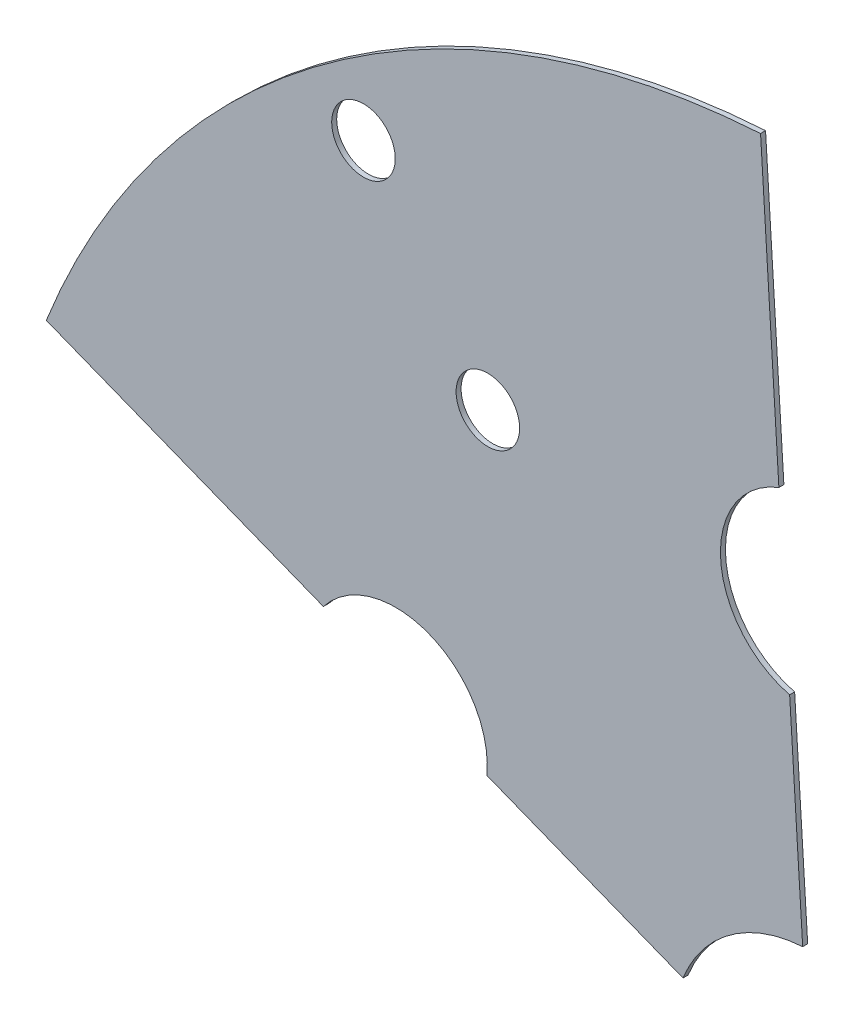
from build123d import *

# Parameters (mm, degrees)
BOSS_EXTRUDE1_DEPTH = 0.3
SKETCH7_R           = 1.905
CUT_EXTRUDE3_DEPTH  = 68.232035618
CUT_EXTRUDE4_DEPTH  = 68.232035618


with BuildPart() as part:
    # Sketch5 → Boss-Extrude1 (new body)
    with BuildSketch(Plane.XY):
        with BuildLine():
            Line((-2.028916314, 32.899205852), (-3.033121883, 49.182561418))
            ThreePointArc((-3.033121883, 49.182561418), (-28.963706092, 39.865121415), (-45.838109317, 18.082917637))
            Line((-45.838109317, 18.082917637), (-30.662034486, 12.096027791))
            Line((-30.662034486, 12.096027791), (-18.848088785, 7.435482008))
            Line((-18.848088785, 7.435482008), (-7.679064705, 3.029354759))
            ThreePointArc((-7.679064705, 3.029354759), (-4.852167258, 6.678435289), (-0.508126089, 8.239346629))
            Line((-0.508126089, 8.239346629), (-1.24718387, 20.223287961))
            Line((-1.24718387, 20.223287961), (-2.028916314, 32.899205852))
        make_face()
    extrude(amount=BOSS_EXTRUDE1_DEPTH)

    # Sketch7 → Cut-Extrude3 (cut, through all)
    with BuildSketch(Plane(origin=(0, 0, 0), x_dir=(-1, 0, 0), z_dir=(0, 0, -1))):
        with Locations((26.831076285, 36.924921792)):
            Circle(SKETCH7_R)
        with Locations((19.375810402, 26.663628618)):
            Circle(SKETCH7_R)
    extrude(amount=-CUT_EXTRUDE3_DEPTH, mode=Mode.SUBTRACT)

    # Sketch8 → Cut-Extrude4 (cut, through all)
    with BuildSketch(Plane(origin=(0, 0, 0), x_dir=(-1, 0, 0), z_dir=(0, 0, -1))):
        with BuildLine():
            Line((1.290332778, 20.922954474), (1.933991563, 31.359985686))
            ThreePointArc((1.933991563, 31.359985686), (5.427783746, 25.906158112), (1.290332778, 20.922954474))
        make_face()
        with BuildLine():
            Line((29.233104835, 11.532321793), (19.432314115, 7.665956142))
            ThreePointArc((19.432314115, 7.665956142), (22.882252084, 13.27588106), (29.233104835, 11.532321793))
        make_face()
    extrude(amount=-CUT_EXTRUDE4_DEPTH, mode=Mode.SUBTRACT)


solid = part.part
